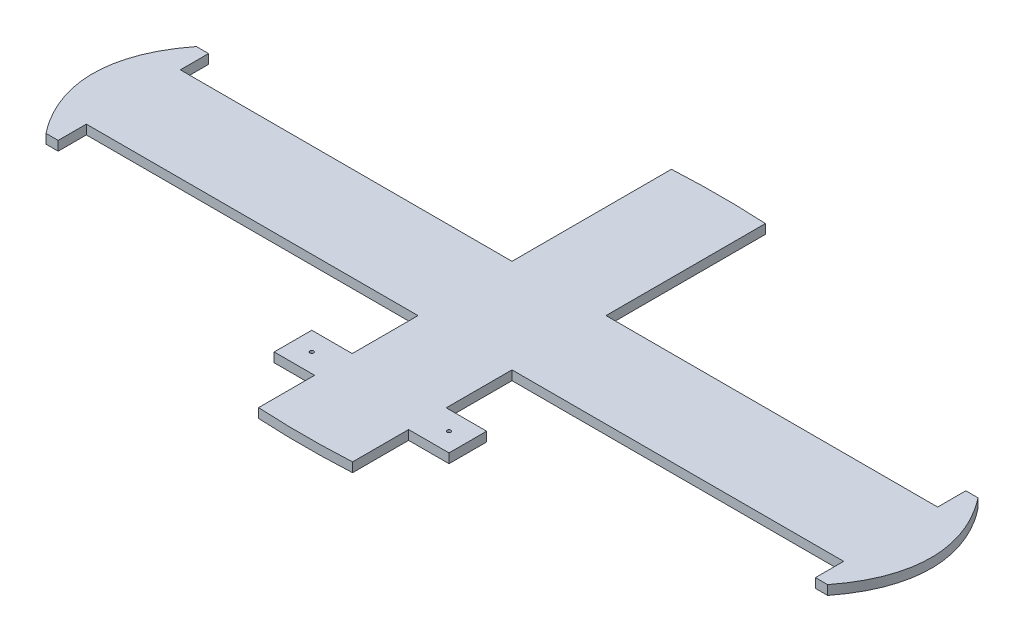
from build123d import *

# Parameters (mm, degrees)
BOSS_EXTRUDE1_DEPTH = 5
SKETCH3_W           = 21.5
SKETCH3_H           = 20
SKETCH3_R           = 1
BOSS_EXTRUDE2_DEPTH = 5


with BuildPart() as part:
    # Sketch1 → Boss-Extrude1 (new body)
    with BuildSketch(Plane(origin=(0, 0, 0), x_dir=(1, 0, 0), z_dir=(0, 1, 0))):
        with BuildLine():
            Line((25, 25), (201.409203428, 25))
            Line((201.409203428, 25), (201.409203428, 40))
            Line((201.409203428, 40), (207.876498783, 40))
            add(Edge.make_bspline(
                [(207.876498783, -40), (239.223771283, 0), (207.876498783, 40)],
                knots=[2.771189847, 2.771189847, 2.771189847, 3.51199546, 3.51199546, 3.51199546], degree=2, weights=[1, 0.932181609, 1]))
            Line((207.876498783, -40), (201.409203428, -40))
            Line((201.409203428, -40), (201.409203428, -25))
            Line((201.409203428, -25), (25, -25))
            Line((25, -25), (25, -109.803415805))
            add(Edge.make_bspline(
                [(-25, -109.803415805), (0, -111.20100327), (25, -109.803415805)],
                knots=[1.458452535, 1.458452535, 1.458452535, 1.683140119, 1.683140119, 1.683140119], degree=2, weights=[1, 0.993696071, 1]))
            Line((-25, -109.803415805), (-25, -25))
            Line((-25, -25), (-201.409203425, -25))
            Line((-201.409203425, -25), (-201.409203425, -40))
            Line((-201.409203425, -40), (-207.876498783, -40))
            add(Edge.make_bspline(
                [(-207.876498783, 40), (-239.223771283, 0), (-207.876498783, -40)],
                knots=[5.912782501, 5.912782501, 5.912782501, 6.653588114, 6.653588114, 6.653588114], degree=2, weights=[1, 0.932181609, 1]))
            Line((-207.876498783, 40), (-201.409203425, 40))
            Line((-201.409203425, 40), (-201.409203425, 25))
            Line((-201.409203425, 25), (-25, 25))
            Line((-25, 25), (-25, 109.803415805))
            add(Edge.make_bspline(
                [(25, 109.803415805), (0, 111.20100327), (-25, 109.803415805)],
                knots=[4.600045189, 4.600045189, 4.600045189, 4.824732772, 4.824732772, 4.824732772], degree=2, weights=[1, 0.993696071, 1]))
            Line((25, 109.803415805), (25, 25))
        make_face()
    extrude(amount=BOSS_EXTRUDE1_DEPTH)

    # Sketch3 → Boss-Extrude2 (add)
    # profile 1 of 2: a face of its own
    with BuildSketch(Plane(origin=(0, 5, 0), x_dir=(1, 0, 0), z_dir=(0, 1, 0))):
        Polygon((-25, -60), (-36.5, -60), (-46.5, -60), (-46.5, -80), (-25, -80), align=None)
        with BuildLine():
            ThreePointArc((-35.5, -70), (-37.207106781, -70.707106781), (-36.5, -69))
            ThreePointArc((-36.5, -69), (-35.792893219, -69.292893219), (-35.5, -70))
        make_face(mode=Mode.SUBTRACT)
    # profile 2 of 2: a face of its own
    with BuildSketch(Plane(origin=(0, 5, 0), x_dir=(1, 0, 0), z_dir=(0, 1, 0))):
        with Locations((35.75, -70)):
            Rectangle(SKETCH3_W, SKETCH3_H)
        with Locations(Location((36.5, -70, 0), (0, 0, 270))):
            Circle(SKETCH3_R, mode=Mode.SUBTRACT)
    extrude(amount=-BOSS_EXTRUDE2_DEPTH)


solid = part.part
